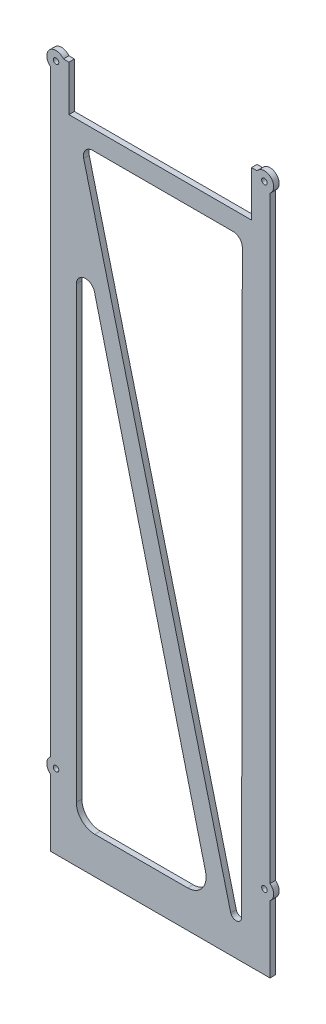
from build123d import *

# Parameters (mm, degrees)
SKETCH_1_R      = 1.5
EXTRUDE_1_DEPTH = 3


with BuildPart() as part:
    # 草图1 → 凸台-拉伸1 (new body)
    with BuildSketch(Plane.XY):
        with BuildLine():
            Line((-3, -336.18), (-3, -372.501331749))
            Line((-3, -372.501331749), (116, -372.501331749))
            Line((116, -372.501331749), (116, -336.18))
            ThreePointArc((116, -336.18), (118, -332.18), (116, -328.18))
            Line((116, -328.18), (116, -4))
            ThreePointArc((116, -4), (116.535533906, 3.535533906), (109, 3))
            Line((109, 3), (106, 3))
            Line((106, 3), (106, -21.645755349))
            Line((106, -21.645755349), (7, -21.645755349))
            Line((7, -21.645755349), (7, 3))
            Line((7, 3), (4, 3))
            ThreePointArc((4, 3), (-3.535533906, 3.535533906), (-3, -4))
            Line((-3, -4), (-3, -328.18))
            ThreePointArc((-3, -328.18), (-5, -332.18), (-3, -336.18))
        make_face()
        Circle(SKETCH_1_R, mode=Mode.SUBTRACT)
        with Locations((113, 0)):
            Circle(SKETCH_1_R, mode=Mode.SUBTRACT)
        with Locations((0, -332.18)):
            Circle(SKETCH_1_R, mode=Mode.SUBTRACT)
        with Locations((113, -332.18)):
            Circle(SKETCH_1_R, mode=Mode.SUBTRACT)
        with BuildLine():
            Line((11, -99.104501604), (11, -342.524894505))
            ThreePointArc((11, -342.524894505), (13.928932188, -349.595962317), (21, -352.524894505))
            Line((21, -352.524894505), (71.385479273, -352.524894505))
            ThreePointArc((71.385479273, -352.524894505), (79.263756472, -348.683851265), (81.089872995, -340.111444179))
            Line((81.089872995, -340.111444179), (20.846592628, -97.875461369))
            ThreePointArc((20.846592628, -97.875461369), (15.380711351, -94.143001673), (11, -99.104501604))
        make_face(mode=Mode.SUBTRACT)
        with BuildLine():
            Line((100.988154046, -37.00591772), (100.615591755, -351.791020996))
            ThreePointArc((100.615591755, -351.791020996), (97.985405334, -354.764589688), (94.70763828, -352.524894505))
            Line((94.70763828, -352.524894505), (15.005818776, -38.229040236))
            ThreePointArc((15.005818776, -38.229040236), (15.906197954, -33.929592957), (19.852411404, -32))
            Line((19.852411404, -32), (95.988157548, -32))
            ThreePointArc((95.988157548, -32), (99.525783065, -33.466558944), (100.988154046, -37.00591772))
        make_face(mode=Mode.SUBTRACT)
    extrude(amount=EXTRUDE_1_DEPTH)


solid = part.part
